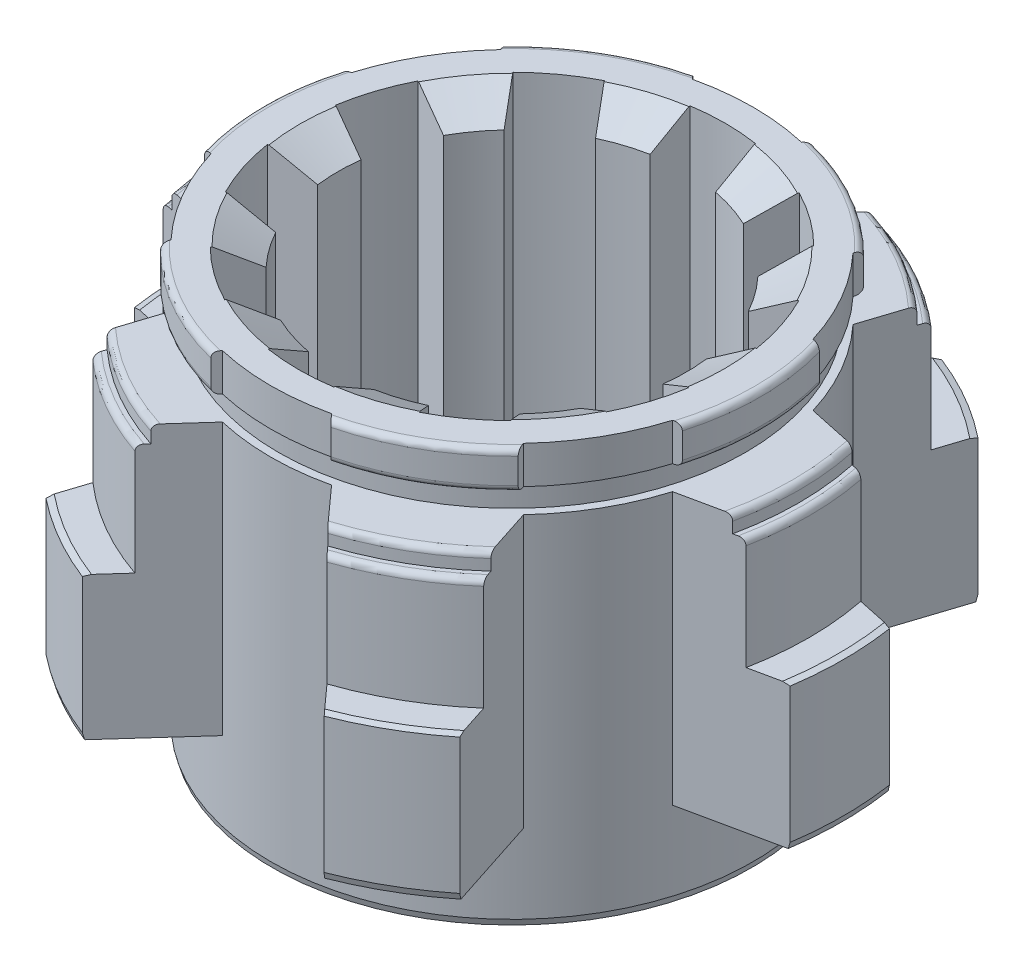
from build123d import *
from OCP.BRepFilletAPI import BRepFilletAPI_MakeChamfer

# Parameters (mm, degrees)
CHANFRO1_SIZE         = 3.15
CHANFRO1_SIZE2        = 1.818653348
CHANFRO2_SIZE         = 3.15
CHANFRO2_SIZE2        = 1.818653348
CHANFRO3_SIZE         = 0.5
CHANFRO3_SIZE2        = 0.133974596
FILETE1_R             = 0.5
CORTE_EXTRUS_O1_DEPTH = 52.829480095
CORTE_EXTRUS_O2_DEPTH = 51.860413375


with BuildPart() as part:
    # Esboço1 → Revolução1 (revolve)
    with BuildSketch(Plane.XY, mode=Mode.PRIVATE) as revolu_o1_sk:
        Polygon((14.35, 52.84039039), (20.5, 52.84039039), (20.5, 49.74039039), (19.25, 49.74039039), (19.25, 47.74039039), (23.65, 47.74039039), (23.65, 46.34039039), (24.5, 46.34039039), (24.5, 37.14039039), (27.35, 37.14039039), (27.35, 25.34039039), (19.9, 25.34039039), (19.9, 18.34039039), (14.35, 18.34039039), align=None)
    revolve(revolu_o1_sk.sketch.rotate(Axis((0, -51.21951952, 0), (0, 1, 0)), 90), axis=Axis((0, -51.21951952, 0), (0, 1, 0)))

    # Chanfro1
    chanfro1_edges = [part.edges().sort_by_distance(p)[0] for p in [
        (0, 52.84039039, 14.35),
    ]]
    chanfro1_side = [part.faces().sort_by_distance(p)[0] for p in [
        (0, 52.84039039, 14.929827561),
    ]]
    chamfer(chanfro1_edges, length=CHANFRO1_SIZE, length2=CHANFRO1_SIZE2, reference=chanfro1_side[0])

    # Chanfro2
    chanfro2_edges = [part.edges().sort_by_distance(p)[0] for p in [
        (0, 18.34039039, 14.35),
    ]]
    chanfro2_side = [part.faces().sort_by_distance(p)[0] for p in [
        (0, 18.34039039, 19.337143002),
    ]]
    chamfer(chanfro2_edges, length=CHANFRO2_SIZE, length2=CHANFRO2_SIZE2, reference=chanfro2_side[0])

    # Chanfro3: one chamfer whose edges measure the first distance from different faces: ONE call of the kernel's chamfer builder (chamfer() names one face for all edges)
    chanfro3_edges_1 = [part.edges().sort_by_distance(p)[0] for p in [
        (0, 25.34039039, 27.35),
    ]]
    chanfro3_side_1 = [part.faces().sort_by_distance(p)[0] for p in [
        (0, 31.24039039, 27.35),
    ]]
    chanfro3_edges_2 = [part.edges().sort_by_distance(p)[0] for p in [
        (0, 37.14039039, 27.35),
    ]]
    chanfro3_side_2 = [part.faces().sort_by_distance(p)[0] for p in [
        (0, 37.14039039, 25.273574819),
    ]]
    chanfro3_edges_3 = [part.edges().sort_by_distance(p)[0] for p in [
        (0, 18.34039039, 19.9),
    ]]
    chanfro3_side_3 = [part.faces().sort_by_distance(p)[0] for p in [
        (0, 21.84039039, 19.9),
    ]]
    chanfro3 = BRepFilletAPI_MakeChamfer(part.part.solid().wrapped)
    for e in chanfro3_edges_1:
        chanfro3.Add(CHANFRO3_SIZE, CHANFRO3_SIZE2, e.wrapped, chanfro3_side_1[0].wrapped)  # the first distance lies on this face
    for e in chanfro3_edges_2:
        chanfro3.Add(CHANFRO3_SIZE, CHANFRO3_SIZE2, e.wrapped, chanfro3_side_2[0].wrapped)  # the first distance lies on this face
    for e in chanfro3_edges_3:
        chanfro3.Add(CHANFRO3_SIZE, CHANFRO3_SIZE2, e.wrapped, chanfro3_side_3[0].wrapped)  # the first distance lies on this face
    add(Compound.cast(chanfro3.Shape()), mode=Mode.REPLACE)

    # Filete1
    filete1_edges = [part.edges().sort_by_distance(p)[0] for p in [
        (0, 46.34039039, 24.5),
        (0, 47.74039039, 23.65),
        (0, 49.74039039, 20.5),
        (0, 52.84039039, 20.5),
    ]]
    fillet(filete1_edges, radius=FILETE1_R)

    # Esboço2 → Corte-extrusão1 (cut, through all)
    with BuildSketch(Plane.XZ.offset(-18.34039039)):
        with BuildLine():
            Line((-4.5, -19.384529914), (-10.863416512, -26.45181993))
            ThreePointArc((-10.863416512, -26.45181993), (0, -28.689263413), (10.863416512, -26.45181993))
            Line((10.863416512, -26.45181993), (4.5, -19.384529914))
            ThreePointArc((4.5, -19.384529914), (0, -19.9), (-4.5, -19.384529914))
        make_face()
        with BuildLine():
            Line((-19.037495346, -5.79515064), (-28.339656292, -3.817915294))
            ThreePointArc((-28.339656292, -3.817915294), (-24.845630932, -14.344631707), (-17.476239779, -22.633904636))
            Line((-17.476239779, -22.633904636), (-14.537495346, -13.589379274))
            ThreePointArc((-14.537495346, -13.589379274), (-17.233905535, -9.95), (-19.037495346, -5.79515064))
        make_face()
        with BuildLine():
            Line((-14.537495346, 13.589379274), (-17.476239779, 22.633904636))
            ThreePointArc((-17.476239779, 22.633904636), (-24.845630932, 14.344631707), (-28.339656292, 3.817915294))
            Line((-28.339656292, 3.817915294), (-19.037495346, 5.79515064))
            ThreePointArc((-19.037495346, 5.79515064), (-17.233905535, 9.95), (-14.537495346, 13.589379274))
        make_face()
        with BuildLine():
            Line((4.5, 19.384529914), (10.863416512, 26.45181993))
            ThreePointArc((10.863416512, 26.45181993), (0, 28.689263413), (-10.863416512, 26.45181993))
            Line((-10.863416512, 26.45181993), (-4.5, 19.384529914))
            ThreePointArc((-4.5, 19.384529914), (0, 19.9), (4.5, 19.384529914))
        make_face()
        with BuildLine():
            Line((19.037495346, 5.79515064), (28.339656292, 3.817915294))
            ThreePointArc((28.339656292, 3.817915294), (24.845630932, 14.344631707), (17.476239779, 22.633904636))
            Line((17.476239779, 22.633904636), (14.537495346, 13.589379274))
            ThreePointArc((14.537495346, 13.589379274), (17.233905535, 9.95), (19.037495346, 5.79515064))
        make_face()
        with BuildLine():
            Line((14.537495346, -13.589379274), (17.476239779, -22.633904636))
            ThreePointArc((17.476239779, -22.633904636), (24.845630932, -14.344631707), (28.339656292, -3.817915294))
            Line((28.339656292, -3.817915294), (19.037495346, -5.79515064))
            ThreePointArc((19.037495346, -5.79515064), (17.233905535, -9.95), (14.537495346, -13.589379274))
        make_face()
    extrude(amount=-CORTE_EXTRUS_O1_DEPTH, mode=Mode.SUBTRACT)

    # Esboço3 → Corte-extrusão2 (cut, through all)
    with BuildSketch(Plane.XZ.offset(-18.34039039)):
        with BuildLine():
            Line((-2.7, -17.39166467), (-2.7, -13.311753491))
            Line((-2.7, -13.311753491), (2.7, -13.311753491))
            Line((2.7, -13.311753491), (2.7, -17.39166467))
            ThreePointArc((2.7, -17.39166467), (0, -17.6), (-2.7, -17.39166467))
        make_face()
        with BuildLine():
            Line((-12.406909891, -12.483132097), (-10.008798269, -9.182414618))
            Line((-10.008798269, -9.182414618), (-5.640106499, -12.356454981))
            Line((-5.640106499, -12.356454981), (-8.038218121, -15.65717246))
            ThreePointArc((-8.038218121, -15.65717246), (-10.34502044, -14.238699101), (-12.406909891, -12.483132097))
        make_face()
        with BuildLine():
            Line((-17.374801899, -2.80646735), (-13.494575786, -1.54570546))
            Line((-13.494575786, -1.54570546), (-11.825884016, -6.681410648))
            Line((-11.825884016, -6.681410648), (-15.706110129, -7.942172538))
            ThreePointArc((-15.706110129, -7.942172538), (-16.738594687, -5.438699101), (-17.374801899, -2.80646735))
        make_face()
        with BuildLine():
            Line((-15.706110129, 7.942172538), (-11.825884016, 6.681410648))
            Line((-11.825884016, 6.681410648), (-13.494575786, 1.54570546))
            Line((-13.494575786, 1.54570546), (-17.374801899, 2.80646735))
            ThreePointArc((-17.374801899, 2.80646735), (-16.738594687, 5.438699101), (-15.706110129, 7.942172538))
        make_face()
        with BuildLine():
            Line((-8.038218121, 15.65717246), (-5.640106499, 12.356454981))
            Line((-5.640106499, 12.356454981), (-10.008798269, 9.182414618))
            Line((-10.008798269, 9.182414618), (-12.406909891, 12.483132097))
            ThreePointArc((-12.406909891, 12.483132097), (-10.34502044, 14.238699101), (-8.038218121, 15.65717246))
        make_face()
        with BuildLine():
            Line((2.7, 17.39166467), (2.7, 13.311753491))
            Line((2.7, 13.311753491), (-2.7, 13.311753491))
            Line((-2.7, 13.311753491), (-2.7, 17.39166467))
            ThreePointArc((-2.7, 17.39166467), (0, 17.6), (2.7, 17.39166467))
        make_face()
        with BuildLine():
            Line((12.406909891, 12.483132097), (10.008798269, 9.182414618))
            Line((10.008798269, 9.182414618), (5.640106499, 12.356454981))
            Line((5.640106499, 12.356454981), (8.038218121, 15.65717246))
            ThreePointArc((8.038218121, 15.65717246), (10.34502044, 14.238699101), (12.406909891, 12.483132097))
        make_face()
        with BuildLine():
            Line((17.374801899, 2.80646735), (13.494575786, 1.54570546))
            Line((13.494575786, 1.54570546), (11.825884016, 6.681410648))
            Line((11.825884016, 6.681410648), (15.706110129, 7.942172538))
            ThreePointArc((15.706110129, 7.942172538), (16.738594687, 5.438699101), (17.374801899, 2.80646735))
        make_face()
        with BuildLine():
            Line((15.706110129, -7.942172538), (11.825884016, -6.681410648))
            Line((11.825884016, -6.681410648), (13.494575786, -1.54570546))
            Line((13.494575786, -1.54570546), (17.374801899, -2.80646735))
            ThreePointArc((17.374801899, -2.80646735), (16.738594687, -5.438699101), (15.706110129, -7.942172538))
        make_face()
        with BuildLine():
            Line((8.038218121, -15.65717246), (5.640106499, -12.356454981))
            Line((5.640106499, -12.356454981), (10.008798269, -9.182414618))
            Line((10.008798269, -9.182414618), (12.406909891, -12.483132097))
            ThreePointArc((12.406909891, -12.483132097), (10.34502044, -14.238699101), (8.038218121, -15.65717246))
        make_face()
    extrude(amount=-CORTE_EXTRUS_O2_DEPTH, mode=Mode.SUBTRACT)


solid = part.part
